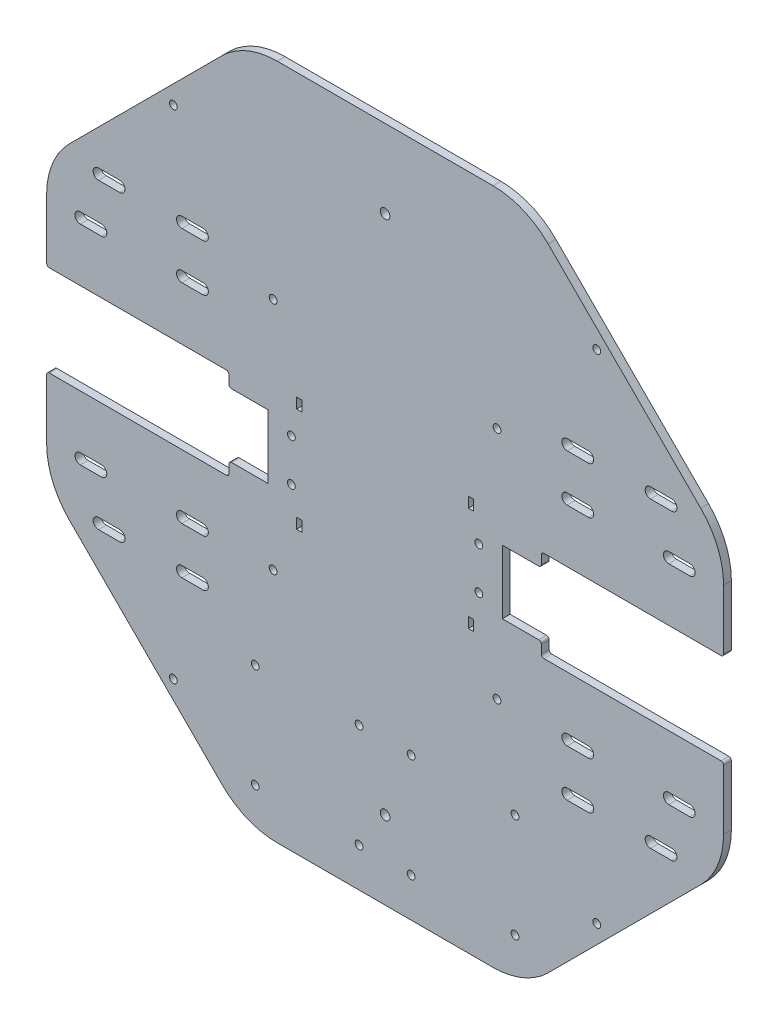
from build123d import *

# Parameters (mm, degrees)
SKETCH1_R           = 1.85
SKETCH1_R_2         = 1.5
BOSS_EXTRUDE1_DEPTH = 3
SKETCH2_R           = 1.5
SKETCH2_W           = 2
SKETCH2_H           = 4
CUT_EXTRUDE1_DEPTH  = 10
FILLET1_R           = 1
FILLET2_R           = 1
SKETCH3_R           = 1.5
CUT_EXTRUDE2_DEPTH  = 10


with BuildPart() as part:
    # Sketch1 → Boss-Extrude1 (new body)
    with BuildSketch(Plane.XY):
        with BuildLine():
            Line((130, 17.5), (130, 41.421356237))
            ThreePointArc((130, 41.421356237), (127.716385975, 52.901859208), (121.213203436, 62.634559673))
            Line((121.213203436, 62.634559673), (62.634559673, 121.213203436))
            ThreePointArc((62.634559673, 121.213203436), (52.901859208, 127.716385975), (41.421356237, 130))
            Line((41.421356237, 130), (-41.421356237, 130))
            ThreePointArc((-41.421356237, 130), (-52.901859208, 127.716385975), (-62.634559673, 121.213203436))
            Line((-62.634559673, 121.213203436), (-121.213203436, 62.634559673))
            ThreePointArc((-121.213203436, 62.634559673), (-127.716385975, 52.901859208), (-130, 41.421356237))
            Line((-130, 41.421356237), (-130, 17.5))
            Line((-130, 17.5), (-60, 17.5))
            Line((-60, 17.5), (-60, 12.25))
            Line((-60, 12.25), (-45, 12.25))
            Line((-45, 12.25), (-45, -12.25))
            Line((-45, -12.25), (-60, -12.25))
            Line((-60, -12.25), (-60, -17.5))
            Line((-60, -17.5), (-130, -17.5))
            Line((-130, -17.5), (-130, -41.421356237))
            ThreePointArc((-130, -41.421356237), (-127.716385975, -52.901859208), (-121.213203436, -62.634559673))
            Line((-121.213203436, -62.634559673), (-62.634559673, -121.213203436))
            ThreePointArc((-62.634559673, -121.213203436), (-52.901859208, -127.716385975), (-41.421356237, -130))
            Line((-41.421356237, -130), (41.421356237, -130))
            ThreePointArc((41.421356237, -130), (52.901859208, -127.716385975), (62.634559673, -121.213203436))
            Line((62.634559673, -121.213203436), (121.213203436, -62.634559673))
            ThreePointArc((121.213203436, -62.634559673), (127.716385975, -52.901859208), (130, -41.421356237))
            Line((130, -41.421356237), (130, -17.5))
            Line((130, -17.5), (60, -17.5))
            Line((60, -17.5), (60, -12.25))
            Line((60, -12.25), (45, -12.25))
            Line((45, -12.25), (45, 12.25))
            Line((45, 12.25), (60, 12.25))
            Line((60, 12.25), (60, 17.5))
            Line((60, 17.5), (130, 17.5))
        make_face()
        with Locations((0, 100)):
            Circle(SKETCH1_R, mode=Mode.SUBTRACT)
        with Locations(Location((0, -100, 0), (0, 0, 180))):
            Circle(SKETCH1_R, mode=Mode.SUBTRACT)
        with Locations((36, 8.1)):
            Circle(SKETCH1_R_2, mode=Mode.SUBTRACT)
        with Locations(Location((36, -8.1, 0), (0, 0, 180))):
            Circle(SKETCH1_R_2, mode=Mode.SUBTRACT)
        with Locations((-36, -8.1)):
            Circle(SKETCH1_R_2, mode=Mode.SUBTRACT)
        with Locations(Location((-36, 8.1, 0), (0, 0, 180))):
            Circle(SKETCH1_R_2, mode=Mode.SUBTRACT)
        with BuildLine():
            Line((69.925, 42.0875), (78.075, 42.0875))
            ThreePointArc((78.075, 42.0875), (80.1125, 40.05), (78.075, 38.0125))
            Line((78.075, 38.0125), (69.925, 38.0125))
            ThreePointArc((69.925, 38.0125), (67.8875, 40.05), (69.925, 42.0875))
        make_face(mode=Mode.SUBTRACT)
        with BuildLine():
            Line((69.925, 60.1375), (78.075, 60.1375))
            ThreePointArc((78.075, 60.1375), (80.1125, 58.1), (78.075, 56.0625))
            Line((78.075, 56.0625), (69.925, 56.0625))
            ThreePointArc((69.925, 56.0625), (67.8875, 58.1), (69.925, 60.1375))
        make_face(mode=Mode.SUBTRACT)
        with BuildLine():
            Line((101.925, 60.1375), (110.075, 60.1375))
            ThreePointArc((110.075, 60.1375), (112.1125, 58.1), (110.075, 56.0625))
            Line((110.075, 56.0625), (101.925, 56.0625))
            ThreePointArc((101.925, 56.0625), (99.8875, 58.1), (101.925, 60.1375))
        make_face(mode=Mode.SUBTRACT)
        with BuildLine():
            Line((108.925, 42.0875), (117.075, 42.0875))
            ThreePointArc((117.075, 42.0875), (119.1125, 40.05), (117.075, 38.0125))
            Line((117.075, 38.0125), (108.925, 38.0125))
            ThreePointArc((108.925, 38.0125), (106.8875, 40.05), (108.925, 42.0875))
        make_face(mode=Mode.SUBTRACT)
        with BuildLine():
            Line((-69.925, 60.1375), (-78.075, 60.1375))
            ThreePointArc((-78.075, 60.1375), (-80.1125, 58.1), (-78.075, 56.0625))
            Line((-78.075, 56.0625), (-69.925, 56.0625))
            ThreePointArc((-69.925, 56.0625), (-67.8875, 58.1), (-69.925, 60.1375))
        make_face(mode=Mode.SUBTRACT)
        with BuildLine():
            Line((-101.925, 60.1375), (-110.075, 60.1375))
            ThreePointArc((-110.075, 60.1375), (-112.1125, 58.1), (-110.075, 56.0625))
            Line((-110.075, 56.0625), (-101.925, 56.0625))
            ThreePointArc((-101.925, 56.0625), (-99.8875, 58.1), (-101.925, 60.1375))
        make_face(mode=Mode.SUBTRACT)
        with BuildLine():
            Line((-108.925, 42.0875), (-117.075, 42.0875))
            ThreePointArc((-117.075, 42.0875), (-119.1125, 40.05), (-117.075, 38.0125))
            Line((-117.075, 38.0125), (-108.925, 38.0125))
            ThreePointArc((-108.925, 38.0125), (-106.8875, 40.05), (-108.925, 42.0875))
        make_face(mode=Mode.SUBTRACT)
        with BuildLine():
            Line((-69.925, 42.0875), (-78.075, 42.0875))
            ThreePointArc((-78.075, 42.0875), (-80.1125, 40.05), (-78.075, 38.0125))
            Line((-78.075, 38.0125), (-69.925, 38.0125))
            ThreePointArc((-69.925, 38.0125), (-67.8875, 40.05), (-69.925, 42.0875))
        make_face(mode=Mode.SUBTRACT)
        with BuildLine():
            Line((101.925, -60.1375), (110.075, -60.1375))
            ThreePointArc((110.075, -60.1375), (112.1125, -58.1), (110.075, -56.0625))
            Line((110.075, -56.0625), (101.925, -56.0625))
            ThreePointArc((101.925, -56.0625), (99.8875, -58.1), (101.925, -60.1375))
        make_face(mode=Mode.SUBTRACT)
        with BuildLine():
            Line((69.925, -60.1375), (78.075, -60.1375))
            ThreePointArc((78.075, -60.1375), (80.1125, -58.1), (78.075, -56.0625))
            Line((78.075, -56.0625), (69.925, -56.0625))
            ThreePointArc((69.925, -56.0625), (67.8875, -58.1), (69.925, -60.1375))
        make_face(mode=Mode.SUBTRACT)
        with BuildLine():
            Line((69.925, -42.0875), (78.075, -42.0875))
            ThreePointArc((78.075, -42.0875), (80.1125, -40.05), (78.075, -38.0125))
            Line((78.075, -38.0125), (69.925, -38.0125))
            ThreePointArc((69.925, -38.0125), (67.8875, -40.05), (69.925, -42.0875))
        make_face(mode=Mode.SUBTRACT)
        with BuildLine():
            Line((108.925, -42.0875), (117.075, -42.0875))
            ThreePointArc((117.075, -42.0875), (119.1125, -40.05), (117.075, -38.0125))
            Line((117.075, -38.0125), (108.925, -38.0125))
            ThreePointArc((108.925, -38.0125), (106.8875, -40.05), (108.925, -42.0875))
        make_face(mode=Mode.SUBTRACT)
        with BuildLine():
            Line((-101.925, -60.1375), (-110.075, -60.1375))
            ThreePointArc((-110.075, -60.1375), (-112.1125, -58.1), (-110.075, -56.0625))
            Line((-110.075, -56.0625), (-101.925, -56.0625))
            ThreePointArc((-101.925, -56.0625), (-99.8875, -58.1), (-101.925, -60.1375))
        make_face(mode=Mode.SUBTRACT)
        with BuildLine():
            Line((-69.925, -60.1375), (-78.075, -60.1375))
            ThreePointArc((-78.075, -60.1375), (-80.1125, -58.1), (-78.075, -56.0625))
            Line((-78.075, -56.0625), (-69.925, -56.0625))
            ThreePointArc((-69.925, -56.0625), (-67.8875, -58.1), (-69.925, -60.1375))
        make_face(mode=Mode.SUBTRACT)
        with BuildLine():
            Line((-69.925, -42.0875), (-78.075, -42.0875))
            ThreePointArc((-78.075, -42.0875), (-80.1125, -40.05), (-78.075, -38.0125))
            Line((-78.075, -38.0125), (-69.925, -38.0125))
            ThreePointArc((-69.925, -38.0125), (-67.8875, -40.05), (-69.925, -42.0875))
        make_face(mode=Mode.SUBTRACT)
        with BuildLine():
            Line((-108.925, -42.0875), (-117.075, -42.0875))
            ThreePointArc((-117.075, -42.0875), (-119.1125, -40.05), (-117.075, -38.0125))
            Line((-117.075, -38.0125), (-108.925, -38.0125))
            ThreePointArc((-108.925, -38.0125), (-106.8875, -40.05), (-108.925, -42.0875))
        make_face(mode=Mode.SUBTRACT)
    extrude(amount=BOSS_EXTRUDE1_DEPTH)

    # Sketch2 → Cut-Extrude1 (cut)
    with BuildSketch(Plane.XY.offset(3)):
        with Locations((-10, -75.1)):
            Circle(SKETCH2_R)
        with Locations((-49.9, -75.1)):
            Circle(SKETCH2_R)
        with Locations((-10, -115)):
            Circle(SKETCH2_R)
        with Locations((-49.9, -115)):
            Circle(SKETCH2_R)
        with Locations((10, -75.1)):
            Circle(SKETCH2_R)
        with Locations((49.9, -75.1)):
            Circle(SKETCH2_R)
        with Locations((49.9, -115)):
            Circle(SKETCH2_R)
        with Locations((10, -115)):
            Circle(SKETCH2_R)
        with Locations((33, -20)):
            Rectangle(SKETCH2_W, SKETCH2_H)
        with Locations((33, 20)):
            Rectangle(SKETCH2_W, SKETCH2_H)
        with Locations((-33, 20)):
            Rectangle(SKETCH2_W, SKETCH2_H)
        with Locations((-33, -20)):
            Rectangle(SKETCH2_W, SKETCH2_H)
    extrude(amount=-CUT_EXTRUDE1_DEPTH, mode=Mode.SUBTRACT)

    # Fillet1
    fillet1_edges = [part.edges().sort_by_distance(p)[0] for p in [
        (130, 17.5, 1.5),
        (60, 17.5, 1.5),
        (60, 12.25, 1.5),
        (60, -12.25, 1.5),
        (60, -17.5, 1.5),
        (130, -17.5, 1.5),
    ]]
    fillet(fillet1_edges, radius=FILLET1_R)

    # Fillet2
    fillet2_edges = [part.edges().sort_by_distance(p)[0] for p in [
        (-130, -17.5, 1.5),
        (-60, -17.5, 1.5),
        (-60, -12.25, 1.5),
        (-60, 12.25, 1.5),
        (-60, 17.5, 1.5),
        (-130, 17.5, 1.5),
    ]]
    fillet(fillet2_edges, radius=FILLET2_R)

    # Sketch3 → Cut-Extrude2 (cut)
    with BuildSketch(Plane.XY.offset(3)):
        with Locations((-43, 50)):
            Circle(SKETCH3_R)
        with Locations((-43, -40)):
            Circle(SKETCH3_R)
        with Locations((43, -40)):
            Circle(SKETCH3_R)
        with Locations((43, 50)):
            Circle(SKETCH3_R)
        with Locations((-81.317279836, 95.45941546)):
            Circle(SKETCH3_R)
        with Locations((81.317279836, 95.45941546)):
            Circle(SKETCH3_R)
        with Locations((81.317279836, -95.45941546)):
            Circle(SKETCH3_R)
        with Locations((-81.317279836, -95.45941546)):
            Circle(SKETCH3_R)
    extrude(amount=-CUT_EXTRUDE2_DEPTH, mode=Mode.SUBTRACT)


solid = part.part
